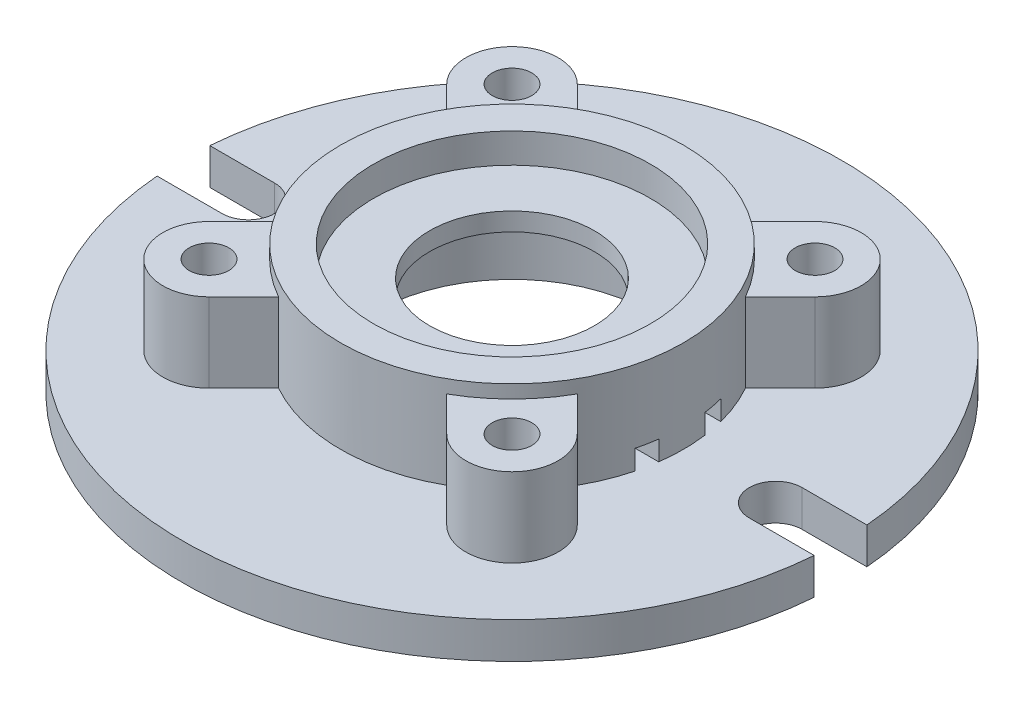
from build123d import *

# Parameters (mm, degrees)
HOLE1_D                 = 50
HOLE1_CBORE_D           = 84
HOLE1_CBORE_DEPTH       = 9
HOLE2_D                 = 84
HOLE2_DEPTH             = 24.5
BOSS_EXTRUDE1_DEPTH     = 24
CIRPATTERN1_COUNT       = 4
HOLE3_D                 = 12
HOLE3_DEPTH             = 24.5
CUT_EXTRUDE2_DEPTH      = 24
CIRPATTERN2_COUNT       = 2
CUT_EXTRUDE3_DEPTH      = 147.482080815
CUT_EXTRUDE3_DEPTH_BACK = 147.482080815
SKETCH12_W              = 6
SKETCH12_H              = 6


with BuildPart() as part:
    # Sketch1 → Revolve1 (revolve)
    with BuildSketch(Plane.XY, mode=Mode.PRIVATE) as revolve1_sk:
        Polygon((0, 0), (0, 39), (-52, 39), (-52, 11), (-100, 11), (-100, 0), align=None)
    revolve(revolve1_sk.sketch.rotate(Axis((0, 0, 0), (0, 1, 0)), 270), axis=Axis((0, 0, 0), (0, 1, 0)))

    # Hole1 (through all)
    with Locations(Plane(origin=(0, 39, 0), x_dir=(1, 0, 0), z_dir=(0, 1, 0))):
        with Locations((0, 0)):
            CounterBoreHole(HOLE1_D / 2, HOLE1_CBORE_D / 2, HOLE1_CBORE_DEPTH)

    # Hole2
    with Locations(Plane(origin=(0, 0, 0), x_dir=(-1, 0, 0), z_dir=(0, -1, 0))):
        with Locations((0, 0)):
            Hole(HOLE2_D / 2, depth=HOLE2_DEPTH)

    # Sketch8 → Boss-Extrude1 (add)
    with BuildSketch(Plane(origin=(0, 11, 0), x_dir=(1, 0, 0), z_dir=(0, 1, 0))):
        with BuildLine():
            Line((25.512367483, 45.311357356), (36.062445841, 55.861435714))
            ThreePointArc((36.062445841, 55.861435714), (55.861435714, 55.861435714), (55.861435714, 36.062445841))
            Line((55.861435714, 36.062445841), (45.311357356, 25.512367483))
            ThreePointArc((45.311357356, 25.512367483), (36.769552622, 36.769552622), (25.512367483, 45.311357356))
        make_face()
    boss_extrude1 = extrude(amount=BOSS_EXTRUDE1_DEPTH)

    # CirPattern1: Boss-Extrude1 ×4 about axis
    cirpattern1_axis = Axis((0, 0, 0), (0, 1, 0))
    for i in range(1, CIRPATTERN1_COUNT):
        add(boss_extrude1.rotate(cirpattern1_axis, i * 360 / CIRPATTERN1_COUNT))

    # Hole3
    with Locations(Plane(origin=(0, 35, 0), x_dir=(1, 0, 0), z_dir=(0, 1, 0))):
        with Locations((45.961940777, 45.961940777), (45.961940777, -45.961940777), (-45.961940777, -45.961940777), (-45.961940777, 45.961940777)):
            Hole(HOLE3_D / 2, depth=HOLE3_DEPTH)

    # Sketch11 → Cut-Extrude2 (cut)
    with BuildSketch(Plane(origin=(0, 11, 0), x_dir=(1, 0, 0), z_dir=(0, 1, 0))):
        with BuildLine():
            Line((80, 8), (120, 8))
            ThreePointArc((120, 8), (128, 0), (120, -8))
            Line((120, -8), (80, -8))
            ThreePointArc((80, -8), (72, 0), (80, 8))
        make_face()
    cut_extrude2 = extrude(amount=-CUT_EXTRUDE2_DEPTH, mode=Mode.SUBTRACT)

    # CirPattern2: Cut-Extrude2 ×2 about axis
    cirpattern2_axis = Axis((0, 0, 0), (0, 1, 0))
    for i in range(1, CIRPATTERN2_COUNT):
        add(cut_extrude2.rotate(cirpattern2_axis, i * 360 / CIRPATTERN2_COUNT), mode=Mode.SUBTRACT)

    # Sketch12 → Cut-Extrude3 (cut, two sides: drawn at the far end of the back side and taken through both)
    with BuildSketch(Plane(origin=(0, 0, 0), x_dir=(0, 0, -1), z_dir=(1, 0, 0)).offset(-CUT_EXTRUDE3_DEPTH_BACK)):
        with Locations((-10, 14)):
            Rectangle(SKETCH12_W, SKETCH12_H)
        with Locations((10, 14)):
            Rectangle(SKETCH12_W, SKETCH12_H)
    extrude(amount=CUT_EXTRUDE3_DEPTH + CUT_EXTRUDE3_DEPTH_BACK, mode=Mode.SUBTRACT)


solid = part.part
